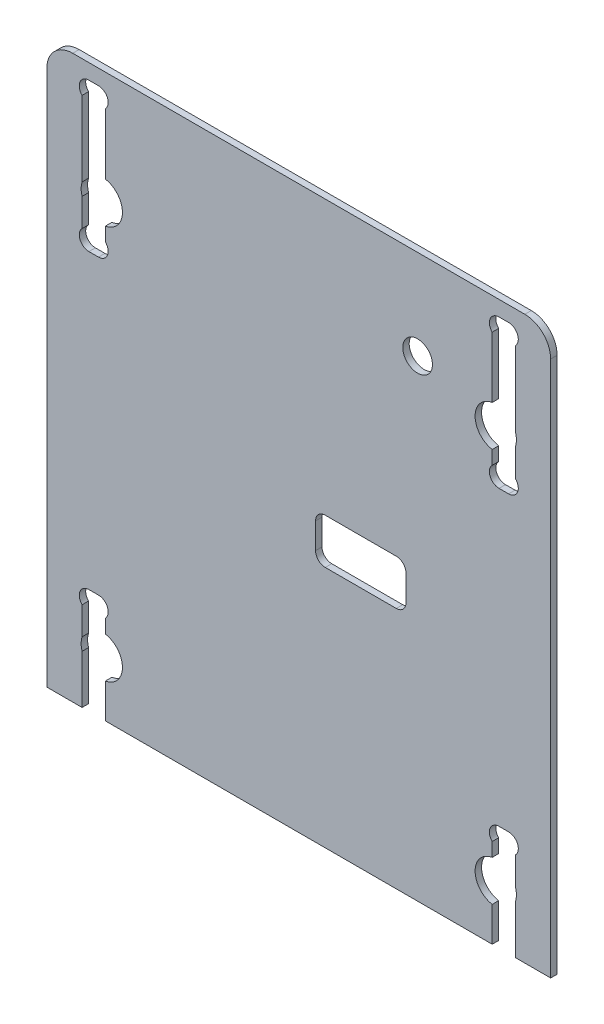
from build123d import *

# Parameters (mm, degrees)
SKETCH1_R                   = 1.15
SHAPE_DEPTH                 = 0.5
CAMERA_CONNECTOR_HOLE_REACH = 32.927
FILLET1_R                   = 2


with BuildPart() as part:
    # Sketch1 → Shape (new body)
    with BuildSketch(Plane.XY):
        with BuildLine():
            Line((19.5, 24), (-19.5, 24))
            Line((-19.5, 24), (-19.5, -19.5))
            Line((-19.5, -19.5), (-16.775, -19.5))
            Line((-16.775, -19.5), (-16.775, -15.734122918))
            ThreePointArc((-16.775, -15.734122918), (-16.85, -15.25), (-16.775, -14.765877082))
            Line((-16.775, -14.765877082), (-16.775, -12.610660172))
            ThreePointArc((-16.775, -12.610660172), (-16.937579563, -11.793317512), (-16.244669914, -11.330330086))
            Line((-16.244669914, -11.330330086), (-15.505330086, -11.330330086))
            ThreePointArc((-15.505330086, -11.330330086), (-14.812420437, -11.793317512), (-14.975, -12.610660172))
            Line((-14.975, -12.610660172), (-14.975, -13.673809973))
            ThreePointArc((-14.975, -13.673809973), (-13.65, -15.25), (-14.975, -16.826190027))
            Line((-14.975, -16.826190027), (-14.975, -19.5))
            Line((-14.975, -19.5), (14.975, -19.5))
            Line((14.975, -19.5), (14.975, -16.826190027))
            ThreePointArc((14.975, -16.826190027), (13.65, -15.25), (14.975, -13.673809973))
            Line((14.975, -13.673809973), (14.975, -12.610660172))
            ThreePointArc((14.975, -12.610660172), (14.812420437, -11.793317512), (15.505330086, -11.330330086))
            Line((15.505330086, -11.330330086), (16.244669914, -11.330330086))
            ThreePointArc((16.244669914, -11.330330086), (16.937579563, -11.793317512), (16.775, -12.610660172))
            Line((16.775, -12.610660172), (16.775, -14.765877082))
            ThreePointArc((16.775, -14.765877082), (16.85, -15.25), (16.775, -15.734122918))
            Line((16.775, -15.734122918), (16.775, -19.5))
            Line((16.775, -19.5), (19.5, -19.5))
            Line((19.5, -19.5), (19.5, 24))
        make_face()
        with BuildLine():
            ThreePointArc((16.244669914, 22.819669914), (16.937579563, 22.356682488), (16.775, 21.539339828))
            Line((16.775, 21.539339828), (16.775, 15.734122918))
            ThreePointArc((16.775, 15.734122918), (16.85, 15.25), (16.775, 14.765877082))
            Line((16.775, 14.765877082), (16.775, 12.610660172))
            ThreePointArc((16.775, 12.610660172), (16.937579563, 11.793317512), (16.244669914, 11.330330086))
            Line((16.244669914, 11.330330086), (15.505330086, 11.330330086))
            ThreePointArc((15.505330086, 11.330330086), (14.812420437, 11.793317512), (14.975, 12.610660172))
            Line((14.975, 12.610660172), (14.975, 13.673809973))
            ThreePointArc((14.975, 13.673809973), (13.65, 15.25), (14.975, 16.826190027))
            Line((14.975, 16.826190027), (14.975, 21.539339828))
            ThreePointArc((14.975, 21.539339828), (14.812420437, 22.356682488), (15.505330086, 22.819669914))
            Line((15.505330086, 22.819669914), (16.244669914, 22.819669914))
        make_face(mode=Mode.SUBTRACT)
        with BuildLine():
            Line((-16.775, 12.610660172), (-16.775, 14.765877082))
            ThreePointArc((-16.775, 14.765877082), (-16.85, 15.25), (-16.775, 15.734122918))
            Line((-16.775, 15.734122918), (-16.775, 21.539339828))
            ThreePointArc((-16.775, 21.539339828), (-16.937579563, 22.356682488), (-16.244669914, 22.819669914))
            Line((-16.244669914, 22.819669914), (-15.505330086, 22.819669914))
            ThreePointArc((-15.505330086, 22.819669914), (-14.812420437, 22.356682488), (-14.975, 21.539339828))
            Line((-14.975, 21.539339828), (-14.975, 16.826190027))
            ThreePointArc((-14.975, 16.826190027), (-13.65, 15.25), (-14.975, 13.673809973))
            Line((-14.975, 13.673809973), (-14.975, 12.610660172))
            ThreePointArc((-14.975, 12.610660172), (-14.812420437, 11.793317512), (-15.505330086, 11.330330086))
            Line((-15.505330086, 11.330330086), (-16.244669914, 11.330330086))
            ThreePointArc((-16.244669914, 11.330330086), (-16.937579563, 11.793317512), (-16.775, 12.610660172))
        make_face(mode=Mode.SUBTRACT)
        with Locations((9.2, 17.05)):
            Circle(SKETCH1_R, mode=Mode.SUBTRACT)
    extrude(amount=SHAPE_DEPTH)

    # Sketch2 → Camera connector hole (cut, up to next)
    with BuildSketch(Plane.XY.offset(0.5), mode=Mode.PRIVATE) as camera_connector_hole_sk1:
        with BuildLine():
            ThreePointArc((1.3, 0.051822129), (1.519669914, -0.478507957), (2.05, -0.698177871))
            Line((2.05, -0.698177871), (7.55, -0.698177871))
            ThreePointArc((7.55, -0.698177871), (8.080330086, -0.478507957), (8.3, 0.051822129))
            Line((8.3, 0.051822129), (8.3, 2.051822129))
            ThreePointArc((8.3, 2.051822129), (8.080330086, 2.582152215), (7.55, 2.801822129))
            Line((7.55, 2.801822129), (2.05, 2.801822129))
            ThreePointArc((2.05, 2.801822129), (1.519669914, 2.582152215), (1.3, 2.051822129))
            Line((1.3, 2.051822129), (1.3, 0.051822129))
        make_face()
    camera_connector_hole_tool1 = extrude(camera_connector_hole_sk1.sketch, amount=-CAMERA_CONNECTOR_HOLE_REACH, mode=Mode.PRIVATE) & part.part
    add(camera_connector_hole_tool1.solids().sort_by_distance((4.8, 1.051822, 0.5))[0], mode=Mode.SUBTRACT)

    # Fillet1
    fillet1_edges = [part.edges().sort_by_distance(p)[0] for p in [
        (19.5, 24, 0.25),
        (-19.5, 24, 0.25),
    ]]
    fillet(fillet1_edges, radius=FILLET1_R)


solid = part.part
